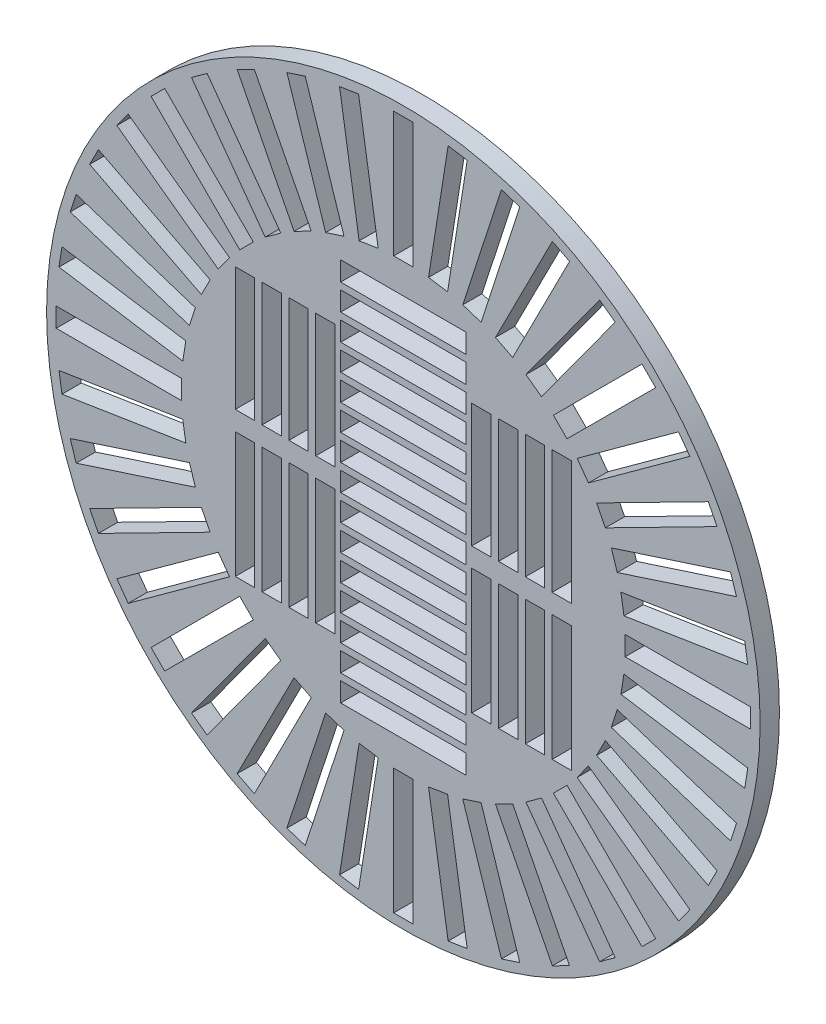
from build123d import *

# Parameters (mm, degrees)
SKETCH1_R          = 37
BASE_DEPTH         = 1
SKETCH_YTRE_RING_W = 2
SKETCH_YTRE_RING_H = 13
YTRE_RING_DEPTH    = 2
CIRPATTERN1_COUNT  = 40
SKETCH3_W          = 13
SKETCH3_H          = 2
SKETCH3_W_2        = 2
SKETCH3_H_2        = 12.816609895
SKETCH3_H_3        = 13
CUT_EXTRUDE1_DEPTH = 10


with BuildPart() as part:
    # Sketch1 → Base (new, symmetric)
    with BuildSketch(Plane.XY):
        Circle(SKETCH1_R)
    extrude(amount=BASE_DEPTH, both=True)

    # Sketch Ytre ring → Ytre ring (cut)
    with BuildSketch(Plane.XY.offset(1)):
        with Locations((0, 29.5)):
            Rectangle(SKETCH_YTRE_RING_W, SKETCH_YTRE_RING_H)
    ytre_ring = extrude(amount=-YTRE_RING_DEPTH, mode=Mode.SUBTRACT)

    # CirPattern1: Ytre ring ×40 about axis
    cirpattern1_axis = Axis((0, 0, 0), (0, 0, 1))
    for i in range(1, CIRPATTERN1_COUNT):
        add(ytre_ring.rotate(cirpattern1_axis, i * 360 / CIRPATTERN1_COUNT), mode=Mode.SUBTRACT)

    # Sketch3 → Cut-Extrude1 (cut)
    with BuildSketch(Plane.XY.offset(1)):
        with Locations((0, 2.7)):
            Rectangle(SKETCH3_W, SKETCH3_H)
        Rectangle(SKETCH3_W, SKETCH3_H)
        with Locations((0, 5.4)):
            Rectangle(SKETCH3_W, SKETCH3_H)
        with Locations((0, 8.1)):
            Rectangle(SKETCH3_W, SKETCH3_H)
        with Locations((0, 10.8)):
            Rectangle(SKETCH3_W, SKETCH3_H)
        with Locations((0, 13.5)):
            Rectangle(SKETCH3_W, SKETCH3_H)
        with Locations((0, 16.2)):
            Rectangle(SKETCH3_W, SKETCH3_H)
        with Locations((0, 18.9)):
            Rectangle(SKETCH3_W, SKETCH3_H)
        with Locations((0, -2.7)):
            Rectangle(SKETCH3_W, SKETCH3_H)
        with Locations((0, -5.4)):
            Rectangle(SKETCH3_W, SKETCH3_H)
        with Locations((0, -8.1)):
            Rectangle(SKETCH3_W, SKETCH3_H)
        with Locations((0, -10.8)):
            Rectangle(SKETCH3_W, SKETCH3_H)
        with Locations((0, -13.5)):
            Rectangle(SKETCH3_W, SKETCH3_H)
        with Locations((0, -16.2)):
            Rectangle(SKETCH3_W, SKETCH3_H)
        with Locations((0, -18.9)):
            Rectangle(SKETCH3_W, SKETCH3_H)
        with Locations((-8.088992718, 7.408304948)):
            Rectangle(SKETCH3_W_2, SKETCH3_H_2)
        with Locations((-8.088992718, -7.5)):
            Rectangle(SKETCH3_W_2, SKETCH3_H_3)
        with Locations((-10.868992718, 7.408304948)):
            Rectangle(SKETCH3_W_2, SKETCH3_H_2)
        with Locations((-10.868992718, -7.5)):
            Rectangle(SKETCH3_W_2, SKETCH3_H_3)
        with Locations((-13.648992718, 7.408304948)):
            Rectangle(SKETCH3_W_2, SKETCH3_H_2)
        with Locations((-13.648992718, -7.5)):
            Rectangle(SKETCH3_W_2, SKETCH3_H_3)
        with Locations((-16.428992718, 7.408304948)):
            Rectangle(SKETCH3_W_2, SKETCH3_H_2)
        with Locations((-16.428992718, -7.5)):
            Rectangle(SKETCH3_W_2, SKETCH3_H_3)
        with Locations((10.868992718, 7.408304948)):
            Rectangle(SKETCH3_W_2, SKETCH3_H_2)
        with Locations((8.088992718, 7.408304948)):
            Rectangle(SKETCH3_W_2, SKETCH3_H_2)
        with Locations((8.088992718, -7.5)):
            Rectangle(SKETCH3_W_2, SKETCH3_H_3)
        with Locations((10.868992718, -7.5)):
            Rectangle(SKETCH3_W_2, SKETCH3_H_3)
        with Locations((13.648992718, 7.408304948)):
            Rectangle(SKETCH3_W_2, SKETCH3_H_2)
        with Locations((13.648992718, -7.5)):
            Rectangle(SKETCH3_W_2, SKETCH3_H_3)
        with Locations((16.428992718, -7.5)):
            Rectangle(SKETCH3_W_2, SKETCH3_H_3)
        with Locations((16.428992718, 7.408304948)):
            Rectangle(SKETCH3_W_2, SKETCH3_H_2)
    extrude(amount=-CUT_EXTRUDE1_DEPTH, mode=Mode.SUBTRACT)


solid = part.part
